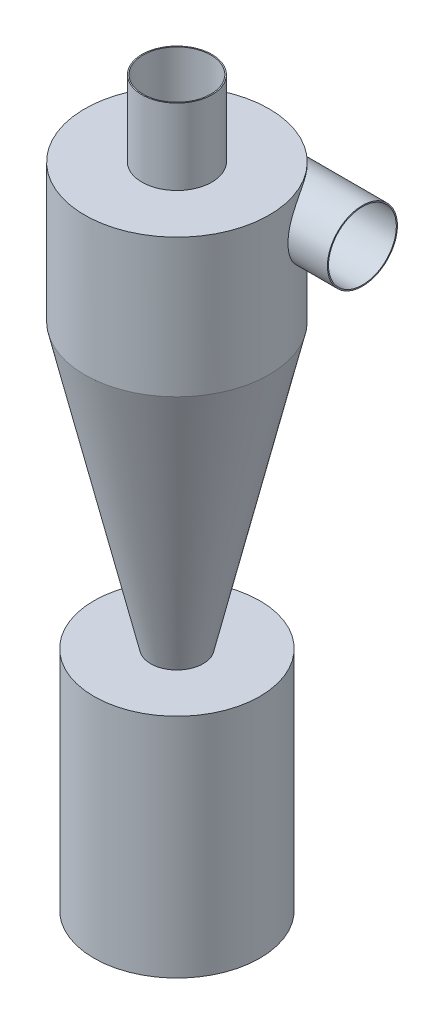
from build123d import *

# Parameters (mm, degrees)
BOSS_EXTRUDE1_REACH      = 829.277
BOSS_EXTRUDE1_END_RADIUS = 100
SKETCH2_R                = 38
SKETCH2_R_2              = 36.8


with BuildPart() as part:
    # Sketch1 → Revolve1 (revolve)
    with BuildSketch(Plane.XY, mode=Mode.PRIVATE) as revolve1_sk:
        Polygon((-100, 703.251175147), (-38, 703.251175147), (-38, 785.358038718), (-36.8, 785.358038718), (-36.8, 631.007989766), (-38, 631.007989766), (-38, 702.051175147), (-98.8, 702.051175147), (-98.8, 553.388924947), (-27.011266135, 244.817440016), (-88.8, 244.817440016), (-88.8, 1.2), (0, 1.2), (0, 0), (-90, 0), (-90, 246.017440016), (-28.522491796, 246.017440016), (-100, 553.251175147), align=None)
    revolve(revolve1_sk.sketch.rotate(Axis((0, 0, 0), (0, 1, 0)), 270), axis=Axis((0, 0, 0), (0, 1, 0)))

    # Boss-Extrude1: up to this cylinder (the profile starts outside it)
    boss_extrude1_end = Plane(origin=(0, 663.787131, 0), z_dir=(0, -1, 0)) * Cylinder(BOSS_EXTRUDE1_END_RADIUS, 1859.554, mode=Mode.PRIVATE)
    # Sketch2 → Boss-Extrude1 (add, up to the surface)
    with BuildSketch(Plane(origin=(140, 0, 0), x_dir=(0, 0, -1), z_dir=(1, 0, 0)), mode=Mode.PRIVATE) as boss_extrude1_sk1:
        with Locations((61.278662137, 663.787130772)):
            Circle(SKETCH2_R)
        with Locations((61.278662137, 663.787130772)):
            Circle(SKETCH2_R_2, mode=Mode.SUBTRACT)
    boss_extrude1_tool1 = extrude(boss_extrude1_sk1.sketch, amount=-BOSS_EXTRUDE1_REACH, mode=Mode.PRIVATE) - boss_extrude1_end
    add(boss_extrude1_tool1.solids().sort_by_distance((140, 663.787131, -24.353464))[0])


solid = part.part
